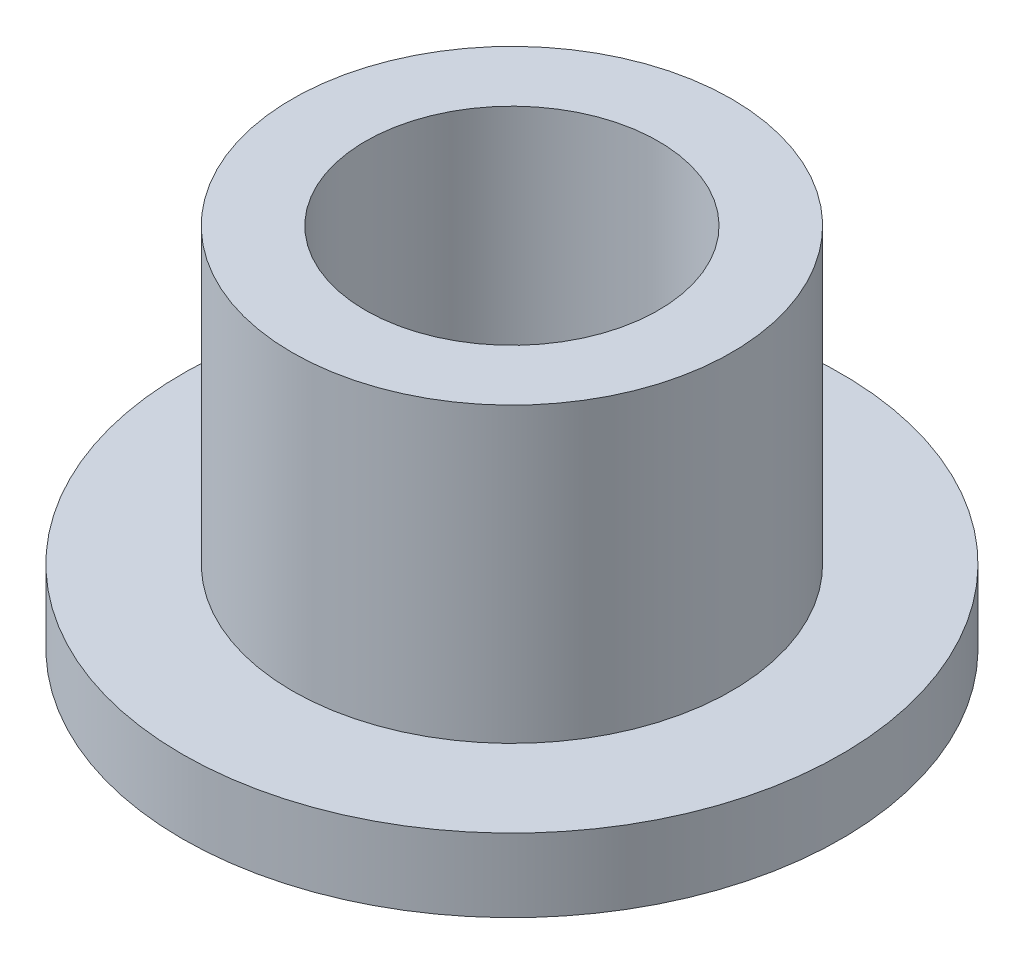
from build123d import *

# Parameters (mm, degrees)
SKETCH1_R           = 14.2875
BOSS_EXTRUDE1_DEPTH = 3.175
SKETCH2_R           = 9.525
SKETCH2_R_2         = 6.35
BOSS_EXTRUDE2_DEPTH = 12.7


with BuildPart() as part:
    # Sketch1 → Boss-Extrude1 (new body)
    with BuildSketch(Plane(origin=(0, 0, 0), x_dir=(1, 0, 0), z_dir=(0, 1, 0))):
        with Locations(Location((0, 0, 0), (0, 0, 270))):
            Circle(SKETCH1_R)
    extrude(amount=BOSS_EXTRUDE1_DEPTH)

    # Sketch2 → Boss-Extrude2 (add)
    with BuildSketch(Plane(origin=(0, 3.175, 0), x_dir=(1, 0, 0), z_dir=(0, 1, 0))):
        with Locations(Location((0, 0, 0), (0, 0, 270))):
            Circle(SKETCH2_R)
        with Locations(Location((0, 0, 0), (0, 0, 270))):
            Circle(SKETCH2_R_2, mode=Mode.SUBTRACT)
    extrude(amount=BOSS_EXTRUDE2_DEPTH)


solid = part.part
